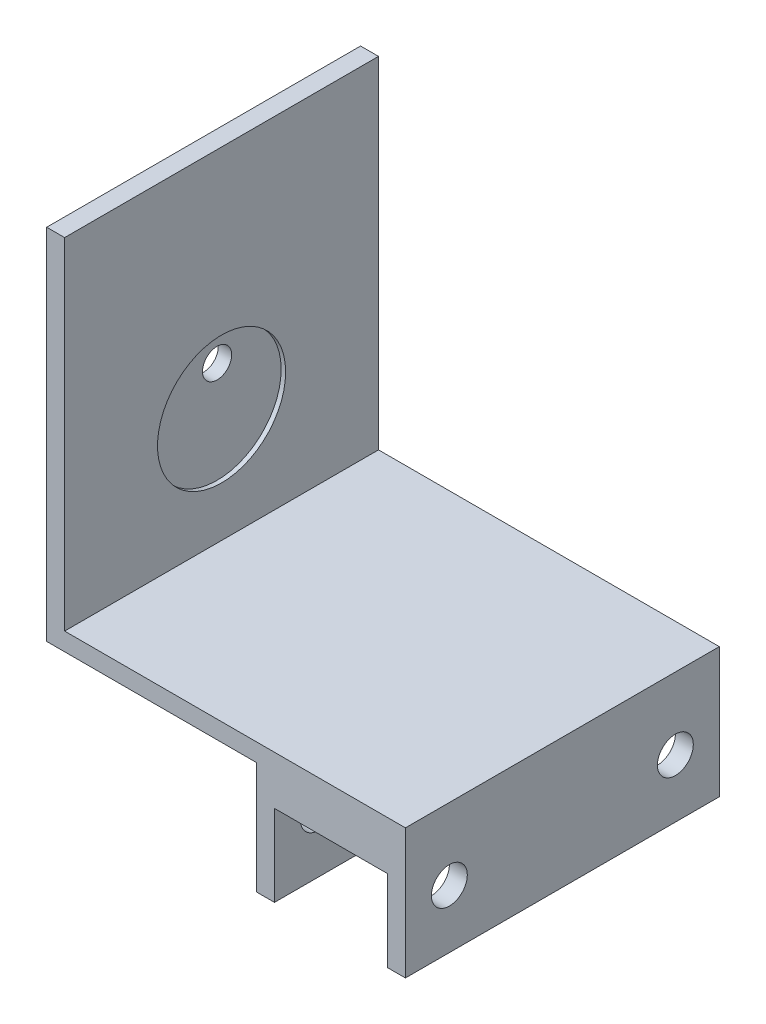
from build123d import *

# Parameters (mm, degrees)
SKETCH1_W           = 80
SKETCH1_H           = 70
BOSS_EXTRUDE1_DEPTH = 4
SKETCH1_3_W         = 4
SKETCH1_3_H         = 70
BOSS_EXTRUDE2_DEPTH = 80
SKETCH1_4_W         = 4
SKETCH1_4_H         = 70
BOSS_EXTRUDE3_DEPTH = 25
SKETCH2_R           = 4
CUT_EXTRUDE1_DEPTH  = 134.041346957
SKETCH3_R           = 3.25
CUT_EXTRUDE2_DEPTH  = 131.675169791
SKETCH3_3_R         = 14.2875
SKETCH3_3_R_2       = 3.25
CUT_EXTRUDE3_DEPTH  = 1
SKETCH1_5_W         = 25.2
SKETCH1_5_H         = 70
BOSS_EXTRUDE4_DEPTH = 6.84


with BuildPart() as part:
    # Sketch1 → Boss-Extrude1 (new body)
    with BuildSketch(Plane(origin=(0, 0, 0), x_dir=(1, 0, 0), z_dir=(0, 1, 0))):
        with Locations((40, 35)):
            Rectangle(SKETCH1_W, SKETCH1_H)
    extrude(amount=BOSS_EXTRUDE1_DEPTH)

    # Sketch1<3> → Boss-Extrude2 (add)
    with BuildSketch(Plane(origin=(0, 0, 0), x_dir=(1, 0, 0), z_dir=(0, 1, 0))):
        with Locations((2, 35)):
            Rectangle(SKETCH1_3_W, SKETCH1_3_H)
    extrude(amount=BOSS_EXTRUDE2_DEPTH)

    # Sketch1<4> → Boss-Extrude3 (add)
    with BuildSketch(Plane(origin=(0, 0, 0), x_dir=(1, 0, 0), z_dir=(0, 1, 0))):
        with Locations((48.8, 35)):
            Rectangle(SKETCH1_4_W, SKETCH1_4_H)
        with Locations((78, 35)):
            Rectangle(SKETCH1_4_W, SKETCH1_4_H)
    extrude(amount=-BOSS_EXTRUDE3_DEPTH)

    # Sketch2 → Cut-Extrude1 (cut, through all)
    with BuildSketch(Plane(origin=(80, 0, 0), x_dir=(0, 0, -1), z_dir=(1, 0, 0))):
        with Locations((60.2, -12)):
            Circle(SKETCH2_R)
        with Locations((9.8, -12)):
            Circle(SKETCH2_R)
    extrude(amount=-CUT_EXTRUDE1_DEPTH, mode=Mode.SUBTRACT)

    # Sketch3 → Cut-Extrude2 (cut, through all)
    with BuildSketch(Plane(origin=(4, 0, 0), x_dir=(0, 0, -1), z_dir=(1, 0, 0))):
        with Locations((35, 37.756)):
            Circle(SKETCH3_R)
    extrude(amount=-CUT_EXTRUDE2_DEPTH, mode=Mode.SUBTRACT)

    # Sketch3<3> → Cut-Extrude3 (cut)
    with BuildSketch(Plane(origin=(4, 0, 0), x_dir=(0, 0, -1), z_dir=(1, 0, 0))):
        with Locations((35, 29.4)):
            Circle(SKETCH3_3_R)
        with Locations((35, 37.756)):
            Circle(SKETCH3_3_R_2, mode=Mode.SUBTRACT)
    extrude(amount=-CUT_EXTRUDE3_DEPTH, mode=Mode.SUBTRACT)

    # Sketch1<5> → Boss-Extrude4 (add)
    with BuildSketch(Plane(origin=(0, 0, 0), x_dir=(1, 0, 0), z_dir=(0, 1, 0))):
        with Locations((63.4, 35)):
            Rectangle(SKETCH1_5_W, SKETCH1_5_H)
    extrude(amount=-BOSS_EXTRUDE4_DEPTH)


solid = part.part
